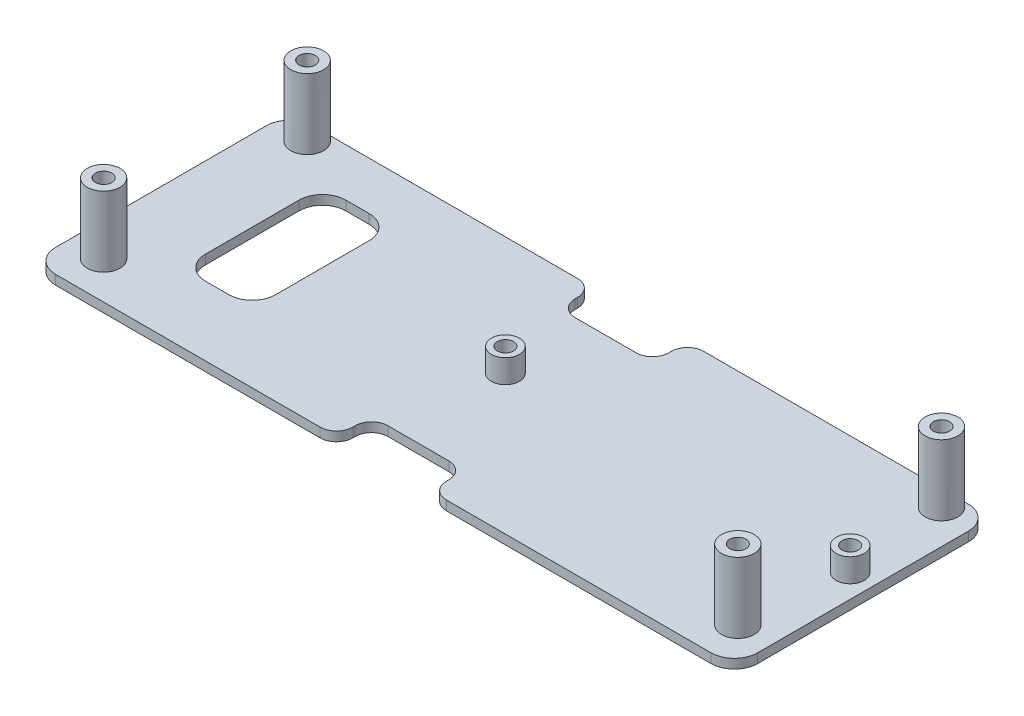
from build123d import *

# Parameters (mm, degrees)
SKETCH1_W           = 15
SKETCH1_H           = 30
BOSS_EXTRUDE1_DEPTH = 2
SKETCH2_R           = 3.5
BOSS_EXTRUDE2_DEPTH = 15
CUT_EXTRUDE1_REACH  = 83.672
SKETCH3_R           = 1.75
SKETCH4_R           = 3
SKETCH4_R_2         = 1.75
BOSS_EXTRUDE3_DEPTH = 5
FILLET1_R           = 5
FILLET2_R           = 3.5


with BuildPart() as part:
    # Sketch1 → Boss-Extrude1 (new body)
    with BuildSketch(Plane(origin=(0, 0, 0), x_dir=(1, 0, 0), z_dir=(0, 1, 0))):
        Polygon((-75, 27.5), (-75, -27.5), (-10, -27.5), (-10, -20), (10, -20), (10, -27.5), (75, -27.5), (75, 27.5), (10, 27.5), (10, 20), (-10, 20), (-10, 27.5), align=None)
        with Locations((-50.25, 2.25)):
            Rectangle(SKETCH1_W, SKETCH1_H, mode=Mode.SUBTRACT)
    extrude(amount=BOSS_EXTRUDE1_DEPTH)

    # Sketch2 → Boss-Extrude2 (add)
    with BuildSketch(Plane(origin=(0, 2, 0), x_dir=(1, 0, 0), z_dir=(0, 1, 0))):
        with Locations(Location((-67.75, -19.5, 0), (0, 0, 270))):
            Circle(SKETCH2_R)
        with Locations(Location((-67.75, 24, 0), (0, 0, 90))):
            Circle(SKETCH2_R)
        with Locations(Location((67.75, 24, 0), (0, 0, 90))):
            Circle(SKETCH2_R)
        with Locations(Location((67.75, -19.5, 0), (0, 0, 270))):
            Circle(SKETCH2_R)
    extrude(amount=BOSS_EXTRUDE2_DEPTH)

    # Sketch3 → Cut-Extrude1 (cut, up to next)
    with BuildSketch(Plane(origin=(0, 17, 0), x_dir=(1, 0, 0), z_dir=(0, 1, 0)), mode=Mode.PRIVATE) as cut_extrude1_sk1:
        with Locations(Location((-67.75, -19.5, 0), (0, 0, 270))):
            Circle(SKETCH3_R)
    cut_extrude1_tool1 = extrude(cut_extrude1_sk1.sketch, amount=-CUT_EXTRUDE1_REACH, mode=Mode.PRIVATE) & part.part
    # Sketch3 → Cut-Extrude1 (cut, up to next)
    with BuildSketch(Plane(origin=(0, 17, 0), x_dir=(1, 0, 0), z_dir=(0, 1, 0)), mode=Mode.PRIVATE) as cut_extrude1_sk2:
        with Locations(Location((-67.75, 24, 0), (0, 0, 270))):
            Circle(SKETCH3_R)
    cut_extrude1_tool2 = extrude(cut_extrude1_sk2.sketch, amount=-CUT_EXTRUDE1_REACH, mode=Mode.PRIVATE) & part.part
    # Sketch3 → Cut-Extrude1 (cut, up to next)
    with BuildSketch(Plane(origin=(0, 17, 0), x_dir=(1, 0, 0), z_dir=(0, 1, 0)), mode=Mode.PRIVATE) as cut_extrude1_sk3:
        with Locations(Location((67.75, 24, 0), (0, 0, 270))):
            Circle(SKETCH3_R)
    cut_extrude1_tool3 = extrude(cut_extrude1_sk3.sketch, amount=-CUT_EXTRUDE1_REACH, mode=Mode.PRIVATE) & part.part
    # Sketch3 → Cut-Extrude1 (cut, up to next)
    with BuildSketch(Plane(origin=(0, 17, 0), x_dir=(1, 0, 0), z_dir=(0, 1, 0)), mode=Mode.PRIVATE) as cut_extrude1_sk4:
        with Locations(Location((67.75, -19.5, 0), (0, 0, 270))):
            Circle(SKETCH3_R)
    cut_extrude1_tool4 = extrude(cut_extrude1_sk4.sketch, amount=-CUT_EXTRUDE1_REACH, mode=Mode.PRIVATE) & part.part
    add(cut_extrude1_tool1.solids().sort_by_distance((-67.75, 17, 19.5))[0], mode=Mode.SUBTRACT)
    add(cut_extrude1_tool2.solids().sort_by_distance((-67.75, 17, -24))[0], mode=Mode.SUBTRACT)
    add(cut_extrude1_tool3.solids().sort_by_distance((67.75, 17, -24))[0], mode=Mode.SUBTRACT)
    add(cut_extrude1_tool4.solids().sort_by_distance((67.75, 17, 19.5))[0], mode=Mode.SUBTRACT)

    # Sketch4 → Boss-Extrude3 (add)
    # profile 1 of 2: a face of its own
    with BuildSketch(Plane(origin=(0, 2, 0), x_dir=(1, 0, 0), z_dir=(0, 1, 0))):
        with Locations(Location((-3.66, 2.25, 0), (0, 0, 270))):
            Circle(SKETCH4_R)
        with Locations(Location((-3.66, 2.25, 0), (0, 0, 270))):
            Circle(SKETCH4_R_2, mode=Mode.SUBTRACT)
    # profile 2 of 2: a face of its own
    with BuildSketch(Plane(origin=(0, 2, 0), x_dir=(1, 0, 0), z_dir=(0, 1, 0))):
        with Locations(Location((70, 2.25, 0), (0, 0, 270))):
            Circle(SKETCH4_R)
        with Locations(Location((70, 2.25, 0), (0, 0, 270))):
            Circle(SKETCH4_R_2, mode=Mode.SUBTRACT)
    extrude(amount=BOSS_EXTRUDE3_DEPTH)

    # Fillet1
    fillet1_edges = [part.edges().sort_by_distance(p)[0] for p in [
        (-57.75, 1, -17.25),
        (-57.75, 1, 12.75),
        (-42.75, 1, 12.75),
        (-42.75, 1, -17.25),
        (-75, 1, 27.5),
        (-75, 1, -27.5),
        (75, 1, -27.5),
        (75, 1, 27.5),
    ]]
    fillet(fillet1_edges, radius=FILLET1_R)

    # Fillet2
    fillet2_edges = [part.edges().sort_by_distance(p)[0] for p in [
        (10, 1, 20),
        (-10, 1, 20),
        (-10, 1, 27.5),
        (-10, 1, -27.5),
        (-10, 1, -20),
        (10, 1, -20),
        (10, 1, -27.5),
        (10, 1, 27.5),
    ]]
    fillet(fillet2_edges, radius=FILLET2_R)


solid = part.part
